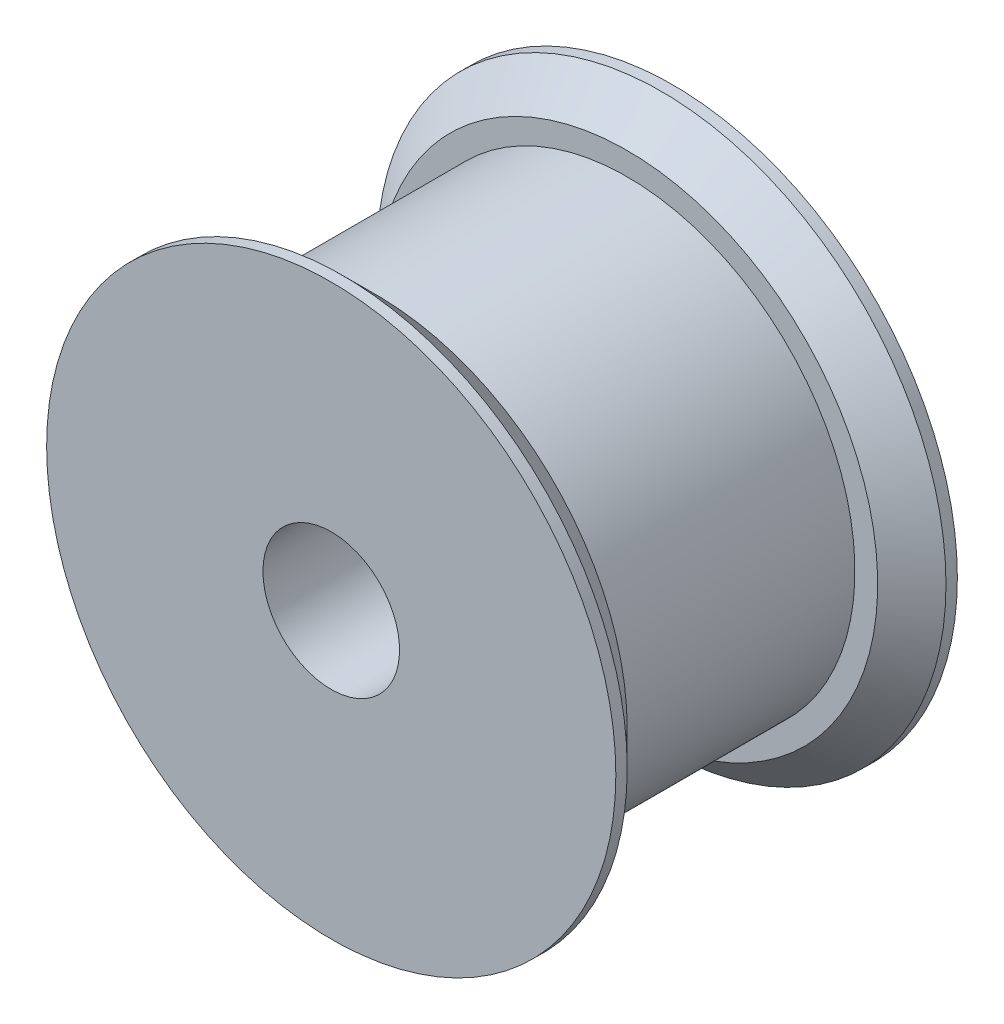
from build123d import *

# Parameters (mm, degrees)
SKETCH2_R          = 3
CUT_EXTRUDE1_DEPTH = 24.184046239
CHAMFER1_SIZE      = 1.5


with BuildPart() as part:
    # Sketch1 → Revolve1 (revolve)
    with BuildSketch(Plane(origin=(0, 0, 0), x_dir=(1, 0, 0), z_dir=(0, 1, 0)), mode=Mode.PRIVATE) as revolve1_sk:
        Polygon((0, 7.5), (12.5, 7.5), (12.5, 5.5), (10, 5.5), (10, -5.5), (12.5, -5.5), (12.5, -7.5), (0, -7.5), align=None)
    revolve(revolve1_sk.sketch.rotate(Axis((0, 0, -16.700819672), (0, 0, 1)), 180), axis=Axis((0, 0, -16.700819672), (0, 0, 1)))

    # Sketch2 → Cut-Extrude1 (cut, through all)
    with BuildSketch(Plane(origin=(0, 0, -7.5), x_dir=(-1, 0, 0), z_dir=(0, 0, -1))):
        Circle(SKETCH2_R)
    extrude(amount=-CUT_EXTRUDE1_DEPTH, mode=Mode.SUBTRACT)

    # Chamfer1
    chamfer1_edges = [part.edges().sort_by_distance(p)[0] for p in [
        (12.5, 0, -5.5),
        (12.5, 0, 5.5),
    ]]
    chamfer(chamfer1_edges, length=CHAMFER1_SIZE)


solid = part.part
